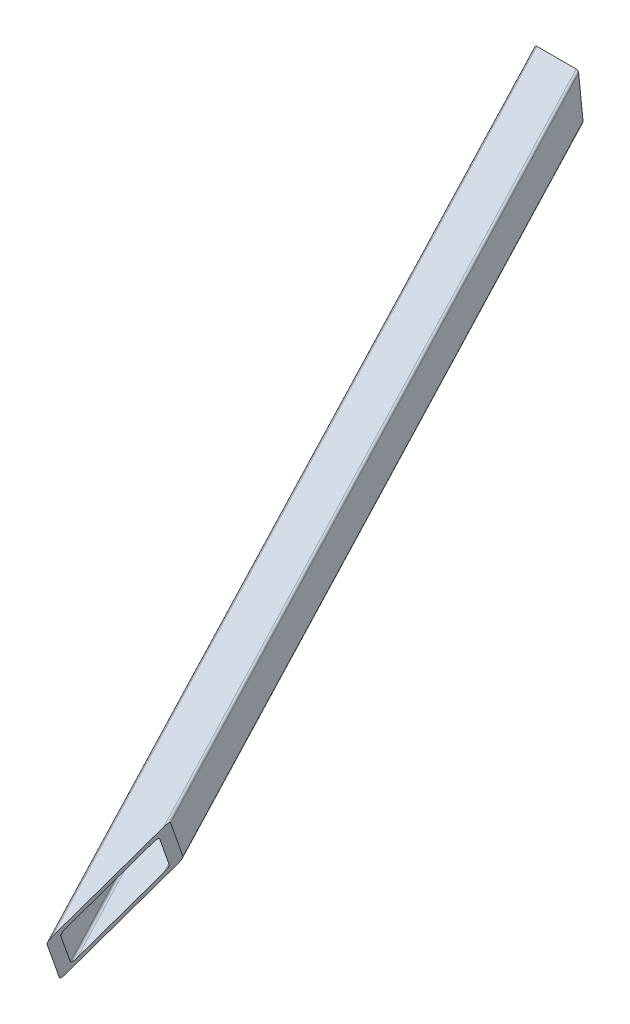
from build123d import *

# Parameters (mm, degrees)
BOSS_EXTRU_1_DEPTH           = 729
ENL_V_MAT_EXTRU_1_DEPTH      = 727
ESQUISSE3_W                  = 40
ESQUISSE3_H                  = 40
BOSS_EXTRU_2_DEPTH           = 814.58026
ENL_V_MAT_EXTRU_2_DEPTH      = 829.69546376
ENL_V_MAT_EXTRU_2_DEPTH_BACK = 829.69546376
ESQUISSE4_W                  = 98.578400591
ESQUISSE4_H                  = 147.950096535
ESQUISSE4_W_2                = 77.840885054
ESQUISSE4_H_2                = 46.084081252
ESQUISSE7_W                  = 821.544509843
ESQUISSE7_H                  = 616.158382383
ESQUISSE7_W_2                = 40
ESQUISSE7_H_2                = 40
ENL_V_MAT_EXTRU_6_DEPTH      = 828.213294061
ESQUISSE8_W                  = 32
ESQUISSE8_H                  = 32
ENL_V_MAT_EXTRU_9_DEPTH      = 828.213294061
CONG_2_R                     = 2


with BuildPart() as part:
    # Esquisse1 → Boss.-Extru.1 (new body)
    with BuildSketch(Plane.XY):
        Polygon((0, 0), (258, 0), (0, 256), align=None)
    extrude(amount=BOSS_EXTRU_1_DEPTH)

    # Esquisse2 → Enlèv. mat.-Extru.1 (cut)
    with BuildSketch(Plane.ZY):
        Polygon((0, 256), (729, 0), (729, 256), align=None)
    extrude(amount=-ENL_V_MAT_EXTRU_1_DEPTH, mode=Mode.SUBTRACT)

    # Esquisse3 → Boss.-Extru.2 (add)
    with BuildSketch(Plane(origin=(0, 256, 0), x_dir=(0.948516525956314, 0.10519863837129277, -0.2987467932423567), z_dir=(0.31672753768478995, -0.31427228545467534, 0.8949394378767902))):
        with Locations((20, -20)):
            Rectangle(ESQUISSE3_W, ESQUISSE3_H)
    extrude(amount=BOSS_EXTRU_2_DEPTH)

    # Esquisse4 → Enlèv. mat.-Extru.2 (cut, two sides: drawn at the far end of the back side and taken through both)
    with BuildSketch(Plane(origin=(0, 0, 0), x_dir=(-1, 0, 0), z_dir=(0, -1, 0)).offset(-ENL_V_MAT_EXTRU_2_DEPTH_BACK)):
        with Locations((-307.289200295, -655.024951733)):
            Rectangle(ESQUISSE4_W, ESQUISSE4_H)
        with Locations((-38.920442527, 23.042040626)):
            Rectangle(ESQUISSE4_W_2, ESQUISSE4_H_2)
    extrude(amount=ENL_V_MAT_EXTRU_2_DEPTH + ENL_V_MAT_EXTRU_2_DEPTH_BACK, mode=Mode.SUBTRACT)

    # Esquisse7 → Enlèv. mat.-Extru.6 (cut, through all)
    with BuildSketch(Plane(origin=(0, 256, 0), x_dir=(0.948516525956314, 0.10519863837129277, -0.2987467932423567), z_dir=(0.31672753768478995, -0.31427228545467534, 0.8949394378767902))):
        with Locations((22.907114777, -53.97111912)):
            Rectangle(ESQUISSE7_W, ESQUISSE7_H)
        with Locations((20, -20)):
            Rectangle(ESQUISSE7_W_2, ESQUISSE7_H_2, mode=Mode.SUBTRACT)
    extrude(amount=ENL_V_MAT_EXTRU_6_DEPTH, mode=Mode.SUBTRACT)

    # Esquisse8 → Enlèv. mat.-Extru.9 (cut, through all)
    with BuildSketch(Plane(origin=(0, 256, 0), x_dir=(0.948516525956314, 0.10519863837129277, -0.2987467932423567), z_dir=(0.31672753768478995, -0.31427228545467534, 0.8949394378767902))):
        with Locations((20, -20)):
            Rectangle(ESQUISSE8_W, ESQUISSE8_H)
    extrude(amount=ENL_V_MAT_EXTRU_9_DEPTH, mode=Mode.SUBTRACT)

    # Congé2
    cong_2_edges = [part.edges().sort_by_distance(p)[0] for p in [
        (131.343588352, 126.087109834, 357.878000354),
        (133.224361668, 94.037568496, 352.563722265),
        (150.092295167, 110.783988508, 304.90200319),
        (148.211521852, 142.833529846, 310.21628128),
        (129, 128, 364.5),
        (150.084916875, 148.933025015, 304.922851157),
        (152.435883519, 108.871098342, 298.280003544),
        (131.350966645, 87.938073327, 357.857152388),
    ]]
    fillet(cong_2_edges, radius=CONG_2_R)


solid = part.part
